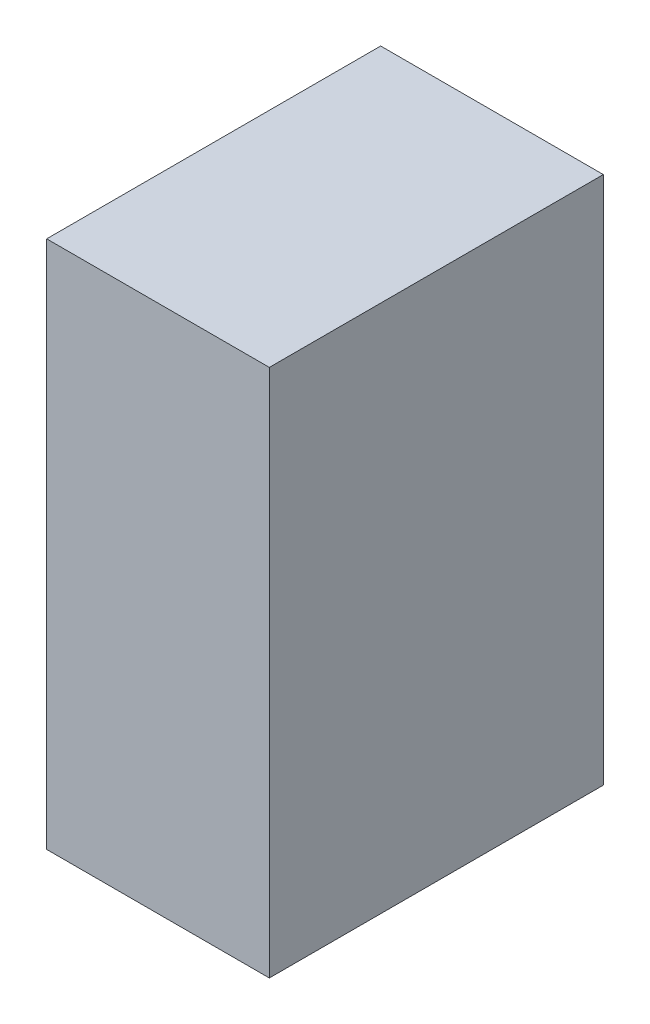
from build123d import *

# Parameters (mm, degrees)
ESQUISSE1_W        = 8
ESQUISSE1_H        = 12
BOSS_EXTRU_1_DEPTH = 19


with BuildPart() as part:
    # Esquisse1 → Boss.-Extru.1 (new body)
    with BuildSketch(Plane(origin=(0, 0, 0), x_dir=(1, 0, 0), z_dir=(0, 1, 0))):
        Rectangle(ESQUISSE1_W, ESQUISSE1_H)
    extrude(amount=BOSS_EXTRU_1_DEPTH)


solid = part.part
